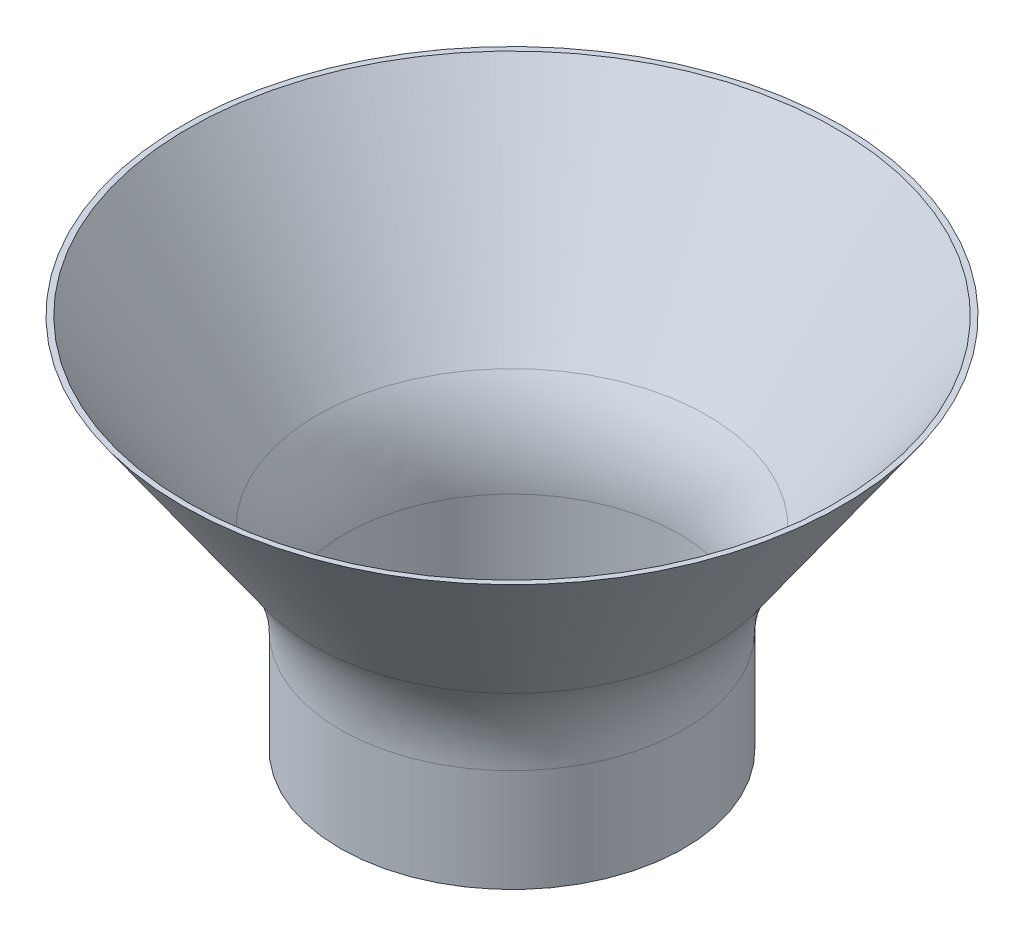
from build123d import *

# Parameters (mm, degrees)
SKETCH1_R           = 29.0449
BOSS_EXTRUDE3_DEPTH = 25.4
SKETCH6_R           = 29.0449
BOSS_EXTRUDE4_DEPTH = 38.1
BOSS_EXTRUDE4_DRAFT = -35
FILLET1_R           = 25.4
SHELL2_T            = -0.762


with BuildPart() as part:
    # Sketch1 → Boss-Extrude3 (new body)
    with BuildSketch(Plane(origin=(0, 0, 0), x_dir=(1, 0, 0), z_dir=(0, 1, 0))):
        with Locations(Location((0, 0, 0), (0, 0, 270))):
            Circle(SKETCH1_R)
    extrude(amount=BOSS_EXTRUDE3_DEPTH)


with BuildPart() as boss_extrude4_tool:
    # Sketch6 → Boss-Extrude4 (with draft: the straight prism first)
    with BuildSketch(Plane(origin=(0, 25.4, 0), x_dir=(1, 0, 0), z_dir=(0, 1, 0))):
        with Locations(Location((0, 0, 0), (0, 0, 270))):
            Circle(SKETCH6_R)
    extrude(amount=BOSS_EXTRUDE4_DEPTH)
    # Boss-Extrude4: the draft: its side faces are tilted about the plane it starts from
    boss_extrude4_sides = [boss_extrude4_tool.faces().sort_by_distance(p)[0] for p in [
        (0, 44.45, -29.0449),
    ]]
    draft(boss_extrude4_sides, Plane(origin=(0, 25.4, 0), x_dir=(1, 0, 0), z_dir=(0, 1, 0)), BOSS_EXTRUDE4_DRAFT)


with BuildPart() as part_1:
    add(part.part)

    # Boss-Extrude4: add boss_extrude4_tool
    add(boss_extrude4_tool.part)

    # Fillet1
    fillet1_edges = [part_1.edges().sort_by_distance(p)[0] for p in [
        (0, 25.4, -29.0449),
    ]]
    fillet(fillet1_edges, radius=FILLET1_R)

    # Shell2
    shell2_openings = [part_1.faces().sort_by_distance(p)[0] for p in [
        (0, 0, 0),
        (0, 63.5, 0),
    ]]
    offset(amount=SHELL2_T, openings=shell2_openings, kind=Kind.INTERSECTION)


solid = part_1.part
